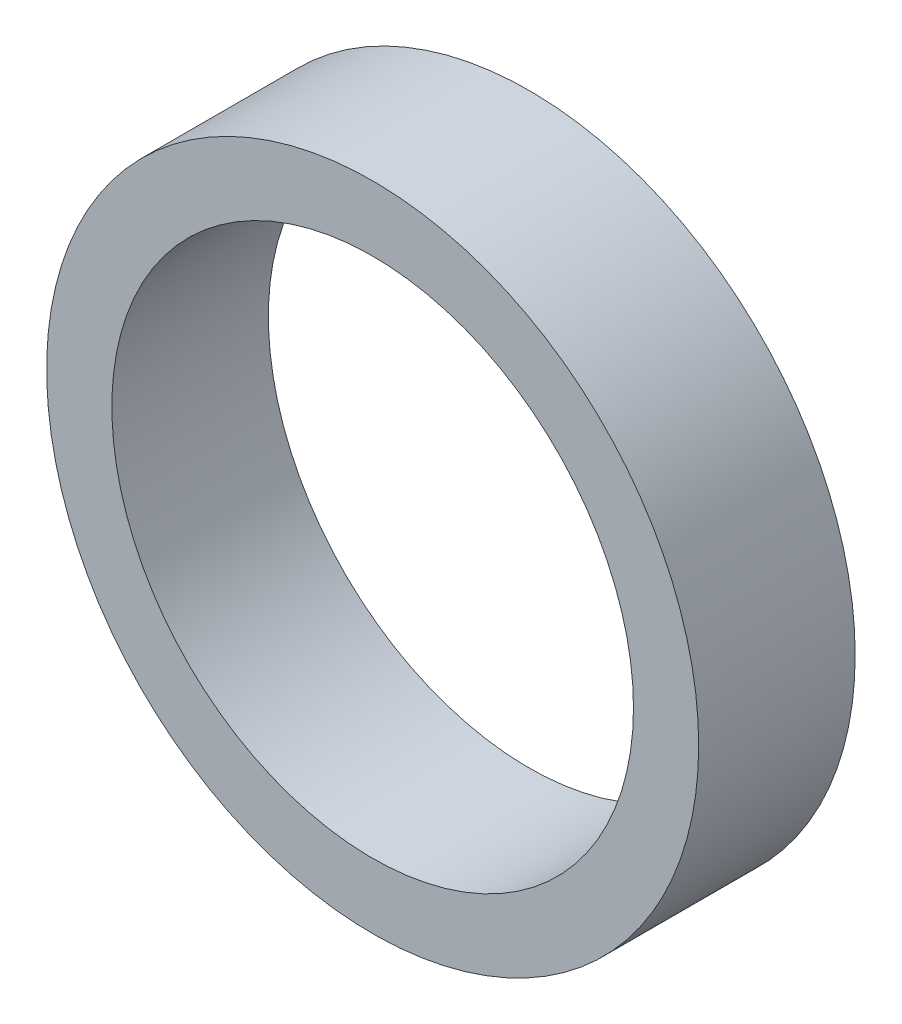
from build123d import *

# Parameters (mm, degrees)
SKETCH1_R           = 7.5
SKETCH1_R_2         = 6
BOSS_EXTRUDE1_DEPTH = 3.6


with BuildPart() as part:
    # Sketch1 → Boss-Extrude1 (new body)
    with BuildSketch(Plane.XY):
        Circle(SKETCH1_R)
        Circle(SKETCH1_R_2, mode=Mode.SUBTRACT)
    extrude(amount=BOSS_EXTRUDE1_DEPTH)


solid = part.part
